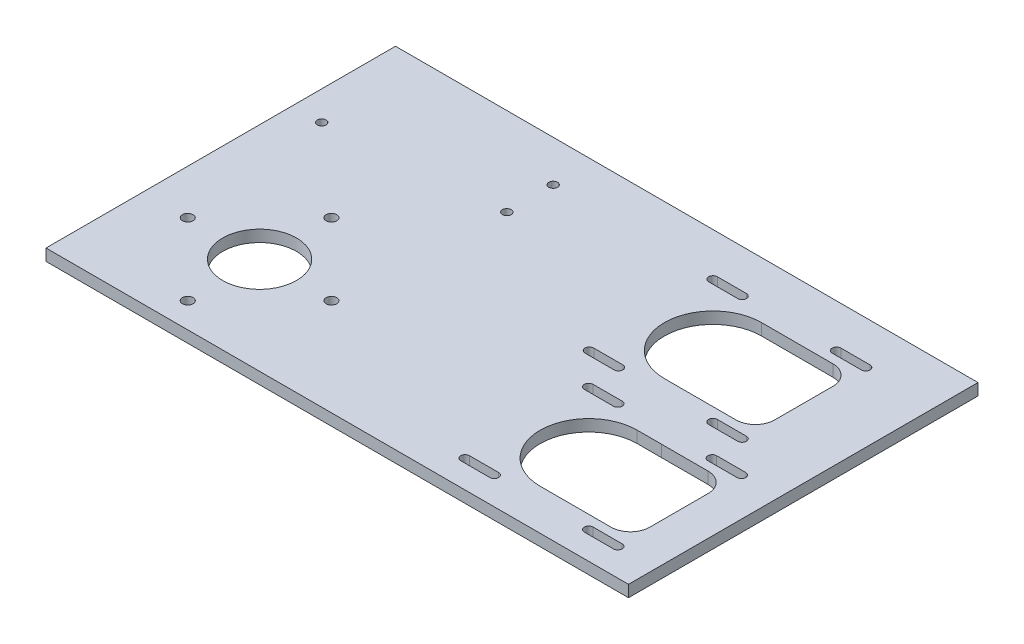
from build123d import *

# Parameters (mm, degrees)
SKETCH1_W            = 290
SKETCH1_H            = 180
BOSS_EXTRUDE1_DEPTH  = 6
SKETCH2_R            = 19
CUT_EXTRUDE1_DEPTH   = 231.295462396
M4_CLEARANCE_HOLE1_D = 4.5
CUT_EXTRUDE3_DEPTH   = 10
CUT_EXTRUDE4_DEPTH   = 10
CUT_EXTRUDE5_DEPTH   = 231.295462396
FILLET1_R            = 10
SKETCH12_W           = 39.319805153
SKETCH12_H           = 50
CUT_EXTRUDE6_DEPTH   = 10
FILLET2_R            = 10
CIRPATTERN1_COUNT    = 4
SKETCH15_W           = 180
SKETCH15_H           = 6
BOSS_EXTRUDE2_DEPTH  = 10


with BuildPart() as part:
    # Sketch1 → Boss-Extrude1 (new body)
    with BuildSketch(Plane(origin=(0, 0, 0), x_dir=(1, 0, 0), z_dir=(0, 1, 0))):
        with Locations((45, 40)):
            Rectangle(SKETCH1_W, SKETCH1_H)
    extrude(amount=BOSS_EXTRUDE1_DEPTH)

    # Sketch2 → Cut-Extrude1 (cut, through all)
    with BuildSketch(Plane(origin=(0, 6, 0), x_dir=(1, 0, 0), z_dir=(0, 1, 0))):
        with Locations((-50, 0)):
            Circle(SKETCH2_R)
    extrude(amount=-CUT_EXTRUDE1_DEPTH, mode=Mode.SUBTRACT)

    # M4 Clearance Hole1 (through all)
    with Locations(Plane(origin=(0, 6, 0), x_dir=(1, 0, 0), z_dir=(0, 1, 0))):
        with Locations((-95, 77), (-7.608586267, 108.807873329), (-7.334866568, 84.669705362)):
            Hole(M4_CLEARANCE_HOLE1_D / 2)

    # Sketch8 → Cut-Extrude3 (cut)
    with BuildSketch(Plane(origin=(0, 6, 0), x_dir=(1, 0, 0), z_dir=(0, 1, 0))):
        with BuildLine():
            Line((75.680194847, 110.069805153), (90.680194847, 110.069805153))
            ThreePointArc((90.680194847, 110.069805153), (92.930194847, 107.819805153), (90.680194847, 105.569805153))
            Line((90.680194847, 105.569805153), (75.680194847, 105.569805153))
            ThreePointArc((75.680194847, 105.569805153), (73.430194847, 107.819805153), (75.680194847, 110.069805153))
        make_face()
        with BuildLine():
            Line((139.319805153, 110.069805153), (154.319805153, 110.069805153))
            ThreePointArc((154.319805153, 110.069805153), (156.569805153, 107.819805153), (154.319805153, 105.569805153))
            Line((154.319805153, 105.569805153), (139.319805153, 105.569805153))
            ThreePointArc((139.319805153, 105.569805153), (137.069805153, 107.819805153), (139.319805153, 110.069805153))
        make_face()
        with BuildLine():
            Line((75.680194847, 46.430194847), (90.680194847, 46.430194847))
            ThreePointArc((90.680194847, 46.430194847), (92.930194847, 44.180194847), (90.680194847, 41.930194847))
            Line((90.680194847, 41.930194847), (75.680194847, 41.930194847))
            ThreePointArc((75.680194847, 41.930194847), (73.430194847, 44.180194847), (75.680194847, 46.430194847))
        make_face()
        with BuildLine():
            Line((139.319805153, 46.430194847), (154.319805153, 46.430194847))
            ThreePointArc((154.319805153, 46.430194847), (156.569805153, 44.180194847), (154.319805153, 41.930194847))
            Line((154.319805153, 41.930194847), (139.319805153, 41.930194847))
            ThreePointArc((139.319805153, 41.930194847), (137.069805153, 44.180194847), (139.319805153, 46.430194847))
        make_face()
        with BuildLine():
            Line((107.5, 101), (122.5, 101))
            ThreePointArc((122.5, 101), (147.5, 76), (122.5, 51))
            Line((122.5, 51), (107.5, 51))
            ThreePointArc((107.5, 51), (82.5, 76), (107.5, 101))
        make_face()
    extrude(amount=-CUT_EXTRUDE3_DEPTH, mode=Mode.SUBTRACT)

    # Sketch9 → Cut-Extrude4 (cut)
    with BuildSketch(Plane(origin=(0, 6, 0), x_dir=(1, 0, 0), z_dir=(0, 1, 0))):
        with BuildLine():
            Line((91.680194847, 30.069805153), (106.680194847, 30.069805153))
            ThreePointArc((106.680194847, 30.069805153), (108.930194847, 27.819805153), (106.680194847, 25.569805153))
            Line((106.680194847, 25.569805153), (91.680194847, 25.569805153))
            ThreePointArc((91.680194847, 25.569805153), (89.430194847, 27.819805153), (91.680194847, 30.069805153))
        make_face()
        with BuildLine():
            Line((155.319805153, 30.069805153), (170.319805153, 30.069805153))
            ThreePointArc((170.319805153, 30.069805153), (172.569805153, 27.819805153), (170.319805153, 25.569805153))
            Line((170.319805153, 25.569805153), (155.319805153, 25.569805153))
            ThreePointArc((155.319805153, 25.569805153), (153.069805153, 27.819805153), (155.319805153, 30.069805153))
        make_face()
        with BuildLine():
            Line((91.680194847, -33.569805153), (106.680194847, -33.569805153))
            ThreePointArc((106.680194847, -33.569805153), (108.930194847, -35.819805153), (106.680194847, -38.069805153))
            Line((106.680194847, -38.069805153), (91.680194847, -38.069805153))
            ThreePointArc((91.680194847, -38.069805153), (89.430194847, -35.819805153), (91.680194847, -33.569805153))
        make_face()
        with BuildLine():
            Line((155.319805153, -33.569805153), (170.319805153, -33.569805153))
            ThreePointArc((170.319805153, -33.569805153), (172.569805153, -35.819805153), (170.319805153, -38.069805153))
            Line((170.319805153, -38.069805153), (155.319805153, -38.069805153))
            ThreePointArc((155.319805153, -38.069805153), (153.069805153, -35.819805153), (155.319805153, -33.569805153))
        make_face()
        with BuildLine():
            Line((123.5, 21), (138.5, 21))
            ThreePointArc((138.5, 21), (163.5, -4), (138.5, -29))
            Line((138.5, -29), (123.5, -29))
            ThreePointArc((123.5, -29), (98.5, -4), (123.5, 21))
        make_face()
    extrude(amount=-CUT_EXTRUDE4_DEPTH, mode=Mode.SUBTRACT)

    # Sketch10 → Cut-Extrude5 (cut, through all)
    with BuildSketch(Plane(origin=(0, 6, 0), x_dir=(1, 0, 0), z_dir=(0, 1, 0))):
        with BuildLine():
            Line((123.5, 21), (136, 21.004881403))
            Line((136, 21.004881403), (170, 21.004881403))
            Line((170, 21.004881403), (170, -29))
            Line((170, -29), (136, -29))
            Line((136, -29), (123.5, -29))
            ThreePointArc((123.5, -29), (98.5, -4), (123.5, 21))
        make_face()
    extrude(amount=-CUT_EXTRUDE5_DEPTH, mode=Mode.SUBTRACT)

    # Fillet1
    fillet1_edges = [part.edges().sort_by_distance(p)[0] for p in [
        (170, 3, 29),
        (170, 3, -21.004881403),
    ]]
    fillet(fillet1_edges, radius=FILLET1_R)

    # Sketch12 → Cut-Extrude6 (cut)
    with BuildSketch(Plane(origin=(0, 6, 0), x_dir=(1, 0, 0), z_dir=(0, 1, 0))):
        with Locations((134.659902577, 76)):
            Rectangle(SKETCH12_W, SKETCH12_H)
    extrude(amount=-CUT_EXTRUDE6_DEPTH, mode=Mode.SUBTRACT)

    # Fillet2
    fillet2_edges = [part.edges().sort_by_distance(p)[0] for p in [
        (154.319805153, 3, -101),
        (154.319805153, 3, -51),
    ]]
    fillet(fillet2_edges, radius=FILLET2_R)

    # Sketch14 → M5 Clearance Hole2 (revolve, cut)
    with BuildSketch(Plane(origin=(-13, 6, 0), x_dir=(0, 0, 1), z_dir=(1, 0, 0))):
        Polygon((0, 0), (0, 21.652366702), (2.75, 20), (2.75, 0), align=None)
    m5_clearance_hole2 = revolve(axis=Axis((-13, 12.35, 0), (0, -1, 0)), mode=Mode.SUBTRACT)

    # CirPattern1: M5 Clearance Hole2 ×4 about axis
    cirpattern1_axis = Axis((-50, 0, 0), (0, 1, 0))
    for i in range(1, CIRPATTERN1_COUNT):
        add(m5_clearance_hole2.rotate(cirpattern1_axis, i * 360 / CIRPATTERN1_COUNT), mode=Mode.SUBTRACT)

    # Sketch15 → Boss-Extrude2 (add)
    with BuildSketch(Plane.ZY.offset(100)):
        with Locations((-40, 3)):
            Rectangle(SKETCH15_W, SKETCH15_H)
    extrude(amount=BOSS_EXTRUDE2_DEPTH)


solid = part.part
